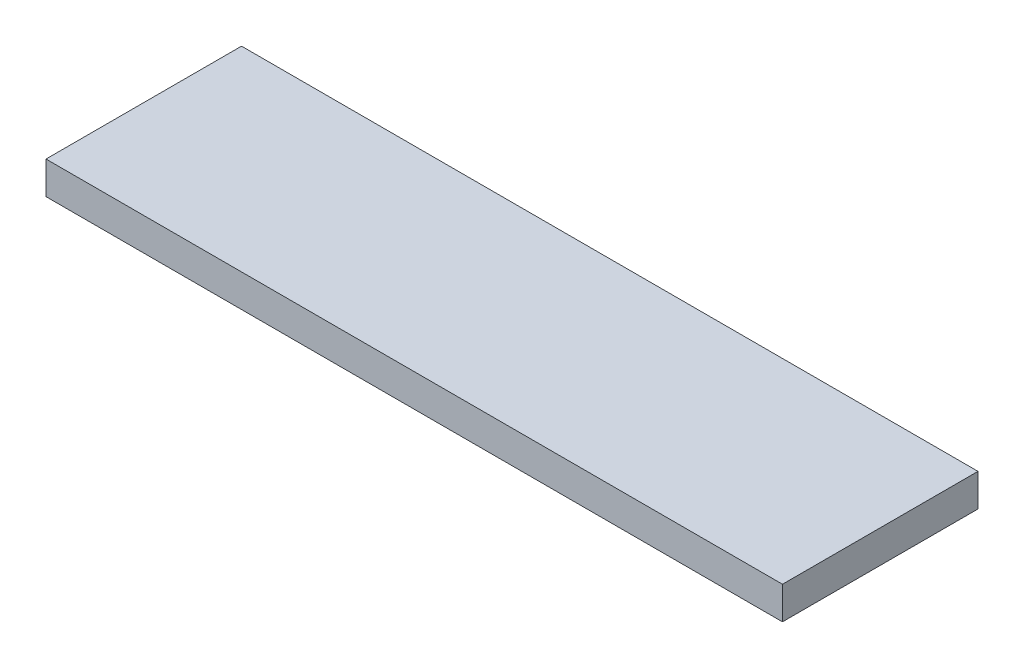
from build123d import *

# Parameters (mm, degrees)
SKETCH1_W           = 226
SKETCH1_H           = 60
BOSS_EXTRUDE1_DEPTH = 10


with BuildPart() as part:
    # Sketch1 → Boss-Extrude1 (new body)
    with BuildSketch(Plane(origin=(0, 0, 0), x_dir=(1, 0, 0), z_dir=(0, 1, 0))):
        Rectangle(SKETCH1_W, SKETCH1_H)
    extrude(amount=BOSS_EXTRUDE1_DEPTH)


solid = part.part
